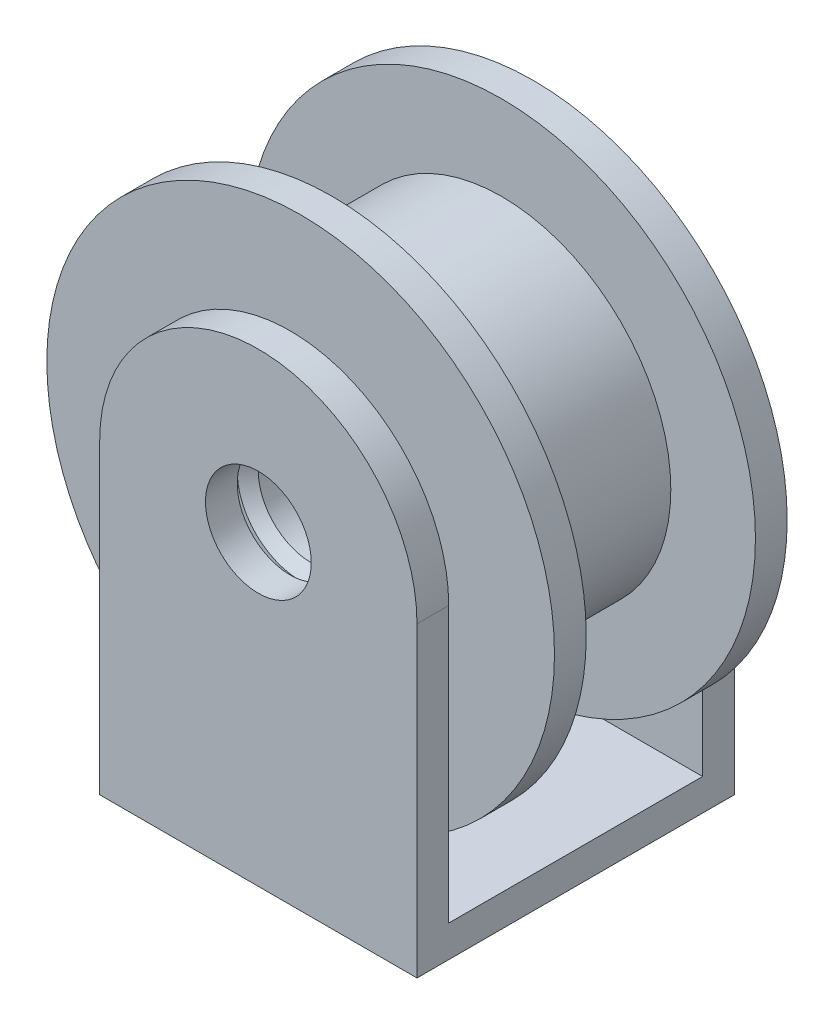
from build123d import *

# Parameters (mm, degrees)
SKETCH_3_R          = 16
EXTRUDE_3_DEPTH     = 16
SKETCH_4_R          = 24
EXTRUDE_4_DEPTH     = 3
EXTRUDE_START       = 3
SKETCH_5_R          = 24
EXTRUDE_5_DEPTH     = 3
SKETCH_6_R          = 5
CUT_EXTRUDE_1_DEPTH = 22
CHAMFER_1_SIZE      = 1
EXTRUDE_6_DEPTH     = 3
EXTRUDE_7_REACH     = 48.325
SKETCH_9_W          = 30
SKETCH_9_H          = 3
SKETCH_10_R         = 5
CUT_EXTRUDE_2_DEPTH = 30
SKETCH_11_R         = 5
CUT_EXTRUDE_3_DEPTH = 3


with BuildPart() as part:
    # 草图3 → 凸台-拉伸3 (new body)
    with BuildSketch(Plane.XY):
        Circle(SKETCH_3_R)
    extrude(amount=EXTRUDE_3_DEPTH)

    # 草图4 → 凸台-拉伸4 (add)
    with BuildSketch(Plane(origin=(0, 0, 0), x_dir=(-1, 0, 0), z_dir=(0, 0, -1))):
        Circle(SKETCH_4_R)
    extrude(amount=EXTRUDE_4_DEPTH)

    # 草图5 → 凸台-拉伸5 (add)
    with BuildSketch(Plane.XY.offset(16).offset(EXTRUDE_START)):
        with Locations(Location((0, 0, 0), (0, 0, 180))):
            Circle(SKETCH_5_R)
    extrude(amount=-EXTRUDE_5_DEPTH)

    # 草图6 → 切除-拉伸1 (cut)
    with BuildSketch(Plane(origin=(0, 0, -3), x_dir=(-1, 0, 0), z_dir=(0, 0, -1))):
        Circle(SKETCH_6_R)
    extrude(amount=-CUT_EXTRUDE_1_DEPTH, mode=Mode.SUBTRACT)

    # 倒角1
    chamfer_1_edges = [part.edges().sort_by_distance(p)[0] for p in [
        (5, 0, -3),
        (5, 0, 19),
    ]]
    chamfer(chamfer_1_edges, length=CHAMFER_1_SIZE)


with BuildPart() as body_2:
    # 草图8 → 凸台-拉伸6 (new body)
    with BuildSketch(Plane(origin=(0, 0, -7), x_dir=(-1, 0, 0), z_dir=(0, 0, -1))):
        with BuildLine():
            Line((-15, 0), (-15, -29))
            Line((-15, -29), (15, -29))
            Line((15, -29), (15, 0))
            ThreePointArc((15, 0), (0, 15), (-15, 0))
        make_face()
    extrude(amount=-EXTRUDE_6_DEPTH)


with BuildPart() as body_3:
    # 镜向5: mirrored copy
    add(body_2.part.mirror(Plane.XY.offset(8)))

    # 草图9 → 凸台-拉伸7 (add, up to next)
    with BuildSketch(Plane.XY.offset(-4), mode=Mode.PRIVATE) as extrude_7_sk1:
        with Locations((0, -27.5)):
            Rectangle(SKETCH_9_W, SKETCH_9_H)
    extrude_7_tool1 = extrude(extrude_7_sk1.sketch, amount=EXTRUDE_7_REACH, mode=Mode.PRIVATE) - body_3.part

    add(body_2.part)  # 凸台-拉伸7 merges body 2
    add(extrude_7_tool1.solids().sort_by_distance((0, -27.5, -4))[0])

    # 草图10 → 切除-拉伸2 (cut)
    with BuildSketch(Plane(origin=(0, 0, -7), x_dir=(-1, 0, 0), z_dir=(0, 0, -1))):
        with Locations(Location((0, 0, 0), (0, 0, 180))):
            Circle(SKETCH_10_R)
    extrude(amount=-CUT_EXTRUDE_2_DEPTH, mode=Mode.SUBTRACT)

    # 草图11 → 切除-拉伸3 (cut)
    with BuildSketch(Plane.XZ.offset(29)):
        with Locations(Location((0, 8, 0), (0, 0, 270))):
            Circle(SKETCH_11_R)
    extrude(amount=-CUT_EXTRUDE_3_DEPTH, mode=Mode.SUBTRACT)


solid = Compound([part.part, body_3.part])
